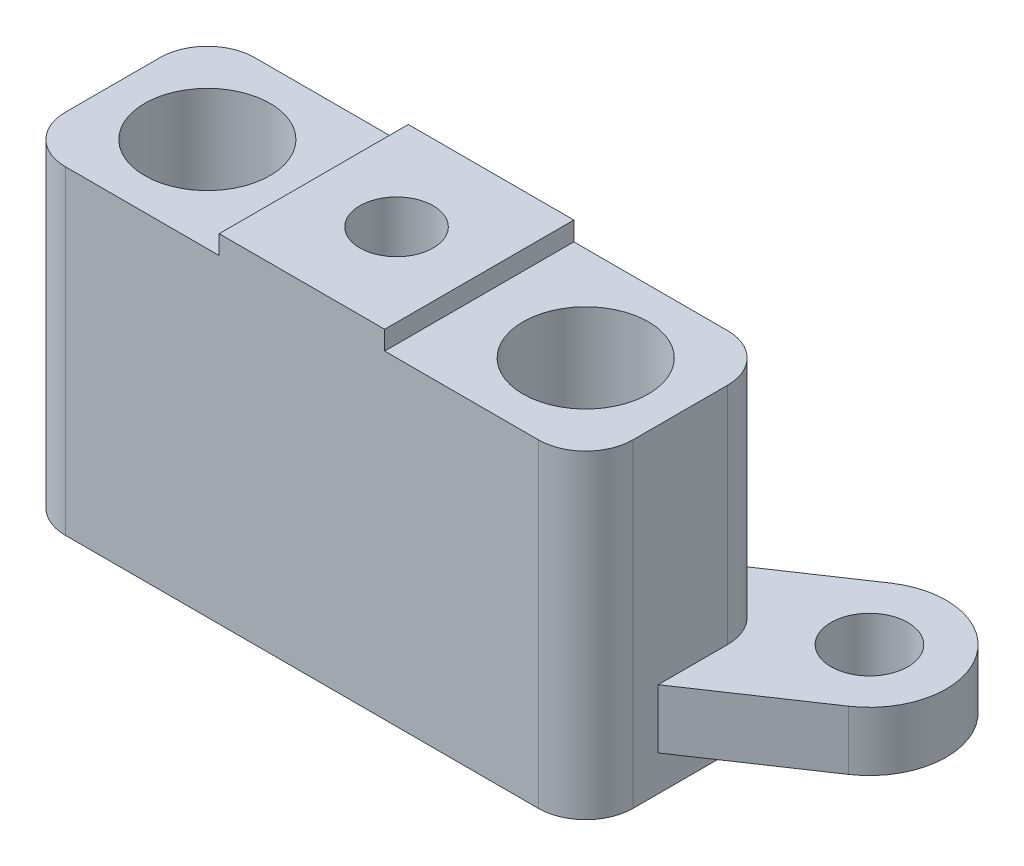
from build123d import *

# Parameters (mm, degrees)
SKETCH25_W          = 7
SKETCH25_H          = 8
BOSS_EXTRUDE5_DEPTH = 12.8
SKETCH26_W          = 24
SKETCH26_H          = 8
SKETCH26_R          = 2.65
BOSS_EXTRUDE6_DEPTH = 12
SKETCH27_R          = 1.55
CUT_EXTRUDE1_DEPTH  = 6.5
SKETCH29_R          = 1.625
BOSS_EXTRUDE8_DEPTH = 2.5
SKETCH31_W          = 24
SKETCH31_H          = 8
BOSS_EXTRUDE9_DEPTH = 1.5
FILLET1_R           = 2


with BuildPart() as part:
    # Sketch25 → Boss-Extrude5 (new body)
    with BuildSketch(Plane(origin=(0, 0, 0), x_dir=(-1, 0, 0), z_dir=(0, 1, 0))):
        Rectangle(SKETCH25_W, SKETCH25_H)
    extrude(amount=BOSS_EXTRUDE5_DEPTH)

    # Sketch26 → Boss-Extrude6 (add)
    with BuildSketch(Plane(origin=(0, 0, 0), x_dir=(-1, 0, 0), z_dir=(0, 1, 0))):
        Rectangle(SKETCH26_W, SKETCH26_H)
        with Locations((-8, 0)):
            Circle(SKETCH26_R, mode=Mode.SUBTRACT)
        with Locations((8, 0)):
            Circle(SKETCH26_R, mode=Mode.SUBTRACT)
    extrude(amount=BOSS_EXTRUDE6_DEPTH)

    # Sketch27 → Cut-Extrude1 (cut)
    with BuildSketch(Plane(origin=(0, 12.8, 0), x_dir=(1, 0, 0), z_dir=(0, 1, 0))):
        Circle(SKETCH27_R)
    extrude(amount=-CUT_EXTRUDE1_DEPTH, mode=Mode.SUBTRACT)

    # Sketch29 → Boss-Extrude8 (add)
    # profile 1 of 2: a face of its own
    with BuildSketch(Plane.XZ):
        with BuildLine():
            Line((-16.813742475, -2.303179977), (-12, 0.934295686))
            Line((-12, 0.934295686), (-12, -4))
            Line((-12, -4), (-7.689524447, -4))
            Line((-7.689524447, -4), (-13.186257525, -7.696820023))
            ThreePointArc((-13.186257525, -7.696820023), (-17.696820023, -6.813742475), (-16.813742475, -2.303179977))
        make_face()
        with Locations((-15, -5)):
            Circle(SKETCH29_R, mode=Mode.SUBTRACT)
    # profile 2 of 2: a face of its own
    with BuildSketch(Plane.XZ):
        with BuildLine():
            Line((16.813742475, -2.303179977), (12, 0.934295686))
            Line((12, 0.934295686), (12, -4))
            Line((12, -4), (7.689524447, -4))
            Line((7.689524447, -4), (13.186257525, -7.696820023))
            ThreePointArc((13.186257525, -7.696820023), (17.696820023, -6.813742475), (16.813742475, -2.303179977))
        make_face()
        with Locations((15, -5)):
            Circle(SKETCH29_R, mode=Mode.SUBTRACT)
    extrude(amount=-BOSS_EXTRUDE8_DEPTH)

    # Sketch31 → Boss-Extrude9 (add)
    with BuildSketch(Plane.XZ):
        Rectangle(SKETCH31_W, SKETCH31_H)
    extrude(amount=BOSS_EXTRUDE9_DEPTH)

    # Fillet1
    fillet1_edges = [part.edges().sort_by_distance(p)[0] for p in [
        (-12, 5.25, 4),
        (12, 5.25, 4),
        (-12, -0.75, -4),
        (12, -0.75, -4),
        (-12, 7.25, -4),
        (12, 7.25, -4),
    ]]
    fillet(fillet1_edges, radius=FILLET1_R)


solid = part.part
